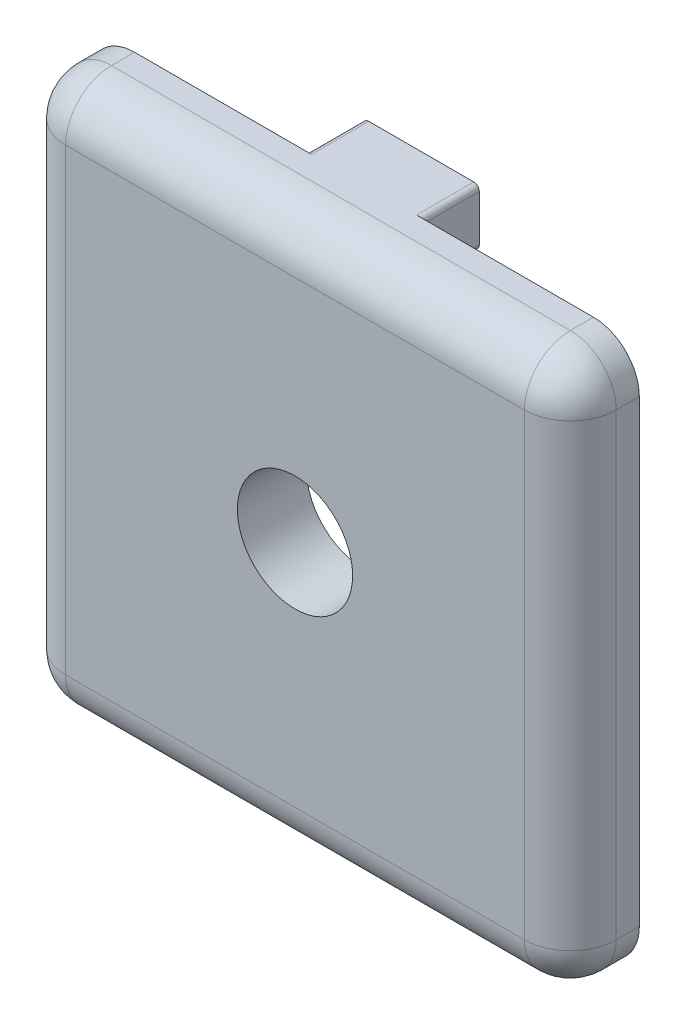
from build123d import *

# Parameters (mm, degrees)
SKETCH1_R      = 3.9878
EXTRUDE1_DEPTH = 4.7752
FILLET1_R      = 3.175
EXTRUDE2_DEPTH = 3.9624


with BuildPart() as part:
    # Sketch1 → Extrude1 (new body)
    with BuildSketch(Plane.XY):
        with BuildLine():
            Line((9.832512944, 1.076805598), (41.582512944, 1.076805598))
            ThreePointArc((41.582512944, 1.076805598), (43.827576974, 2.006741568), (44.757512944, 4.251805598))
            Line((44.757512944, 4.251805598), (44.757512944, 36.001805598))
            ThreePointArc((44.757512944, 36.001805598), (43.827576974, 38.246869628), (41.582512944, 39.176805598))
            Line((41.582512944, 39.176805598), (9.832512944, 39.176805598))
            ThreePointArc((9.832512944, 39.176805598), (7.587448914, 38.246869628), (6.657512944, 36.001805598))
            Line((6.657512944, 36.001805598), (6.657512944, 4.251805598))
            ThreePointArc((6.657512944, 4.251805598), (7.587448914, 2.006741568), (9.832512944, 1.076805598))
        make_face()
        with Locations((25.707512944, 20.126805598)):
            Circle(SKETCH1_R, mode=Mode.SUBTRACT)
    extrude(amount=EXTRUDE1_DEPTH)

    # Fillet1
    fillet1_edges = [part.edges().sort_by_distance(p)[0] for p in [
        (25.707512944, 1.076805598, 4.7752),
        (43.827576974, 2.006741568, 4.7752),
        (44.757512944, 20.126805598, 4.7752),
        (43.827576974, 38.246869628, 4.7752),
        (25.707512944, 39.176805598, 4.7752),
        (7.587448914, 38.246869628, 4.7752),
        (6.657512944, 20.126805598, 4.7752),
        (7.587448914, 2.006741568, 4.7752),
    ]]
    fillet(fillet1_edges, radius=FILLET1_R)

    # Sketch2 → Extrude2 (add)
    with BuildSketch(Plane(origin=(0, 0, 0), x_dir=(-1, 0, 0), z_dir=(0, 0, -1))):
        with BuildLine():
            Line((-29.339712944, 35.214405598), (-22.075312944, 35.214405598))
            ThreePointArc((-22.075312944, 35.214405598), (-21.80590526, 35.325997914), (-21.694312944, 35.595405598))
            Line((-21.694312944, 35.595405598), (-21.694312944, 38.795805598))
            ThreePointArc((-21.694312944, 38.795805598), (-21.80590526, 39.065213281), (-22.075312944, 39.176805598))
            Line((-22.075312944, 39.176805598), (-29.339712944, 39.176805598))
            ThreePointArc((-29.339712944, 39.176805598), (-29.609120627, 39.065213281), (-29.720712944, 38.795805598))
            Line((-29.720712944, 38.795805598), (-29.720712944, 35.595405598))
            ThreePointArc((-29.720712944, 35.595405598), (-29.609120627, 35.325997914), (-29.339712944, 35.214405598))
        make_face()
    extrude(amount=EXTRUDE2_DEPTH)


solid = part.part
